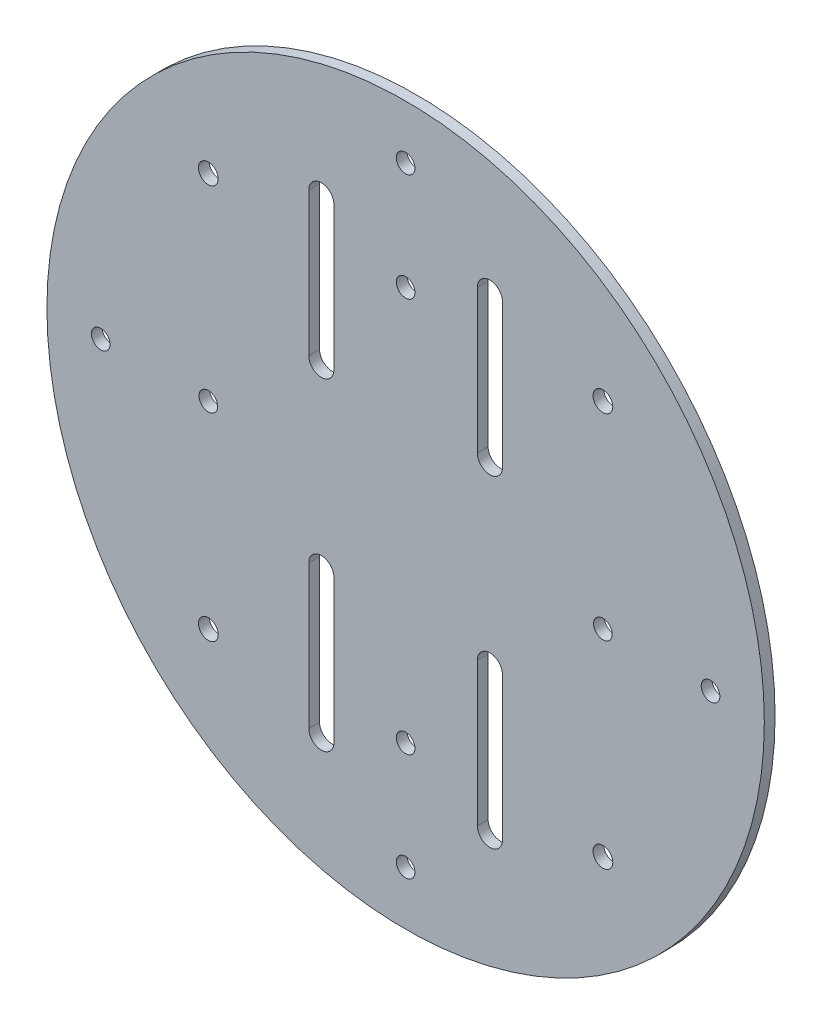
from build123d import *

# Parameters (mm, degrees)
IZIM1_R                              = 100
Y_KSEKLIK_EKSTR_ZYON1_DEPTH          = 30
M5_HELISARMAL_I_IN_Z_VANA_MATKAB_1_D = 5.2
KES_EKSTR_ZYON1_DEPTH                = 145.568322948
M5_BO_LUKLU_DELIK2_D                 = 5.5
IZIM20_R                             = 183.537558205
KES_EKSTR_ZYON2_DEPTH                = 27


with BuildPart() as part:
    # Çizim1 → Yükseklik-Ekstrüzyon1 (new body)
    with BuildSketch(Plane.XY):
        Circle(IZIM1_R)
    extrude(amount=Y_KSEKLIK_EKSTR_ZYON1_DEPTH)

    # M5 Helisarmal için Zıvana matkabı1 (through all)
    with Locations(Plane.XY.offset(30)):
        with Locations((-85, 0), (-55, 0), (0, 55), (0, 85), (55, 0), (85, 0), (0, -55), (0, -85)):
            Hole(M5_HELISARMAL_I_IN_Z_VANA_MATKAB_1_D / 2)

    # Çizim9 → Kes-Ekstrüzyon1 (cut, through all)
    with BuildSketch(Plane.XY.offset(30)):
        with BuildLine():
            Line((27, 65), (27, 25))
            ThreePointArc((27, 25), (23.5, 21.5), (20, 25))
            Line((20, 25), (20, 65))
            ThreePointArc((20, 65), (23.5, 68.5), (27, 65))
        make_face()
        with BuildLine():
            Line((-20, 65), (-20, 25))
            ThreePointArc((-20, 25), (-23.5, 21.5), (-27, 25))
            Line((-27, 25), (-27, 65))
            ThreePointArc((-27, 65), (-23.5, 68.5), (-20, 65))
        make_face()
        with BuildLine():
            Line((-20, -25), (-20, -65))
            ThreePointArc((-20, -65), (-23.5, -68.5), (-27, -65))
            Line((-27, -65), (-27, -25))
            ThreePointArc((-27, -25), (-23.5, -21.5), (-20, -25))
        make_face()
        with BuildLine():
            Line((20, -65), (20, -25))
            ThreePointArc((20, -25), (23.5, -21.5), (27, -25))
            Line((27, -25), (27, -65))
            ThreePointArc((27, -65), (23.5, -68.5), (20, -65))
        make_face()
    extrude(amount=-KES_EKSTR_ZYON1_DEPTH, mode=Mode.SUBTRACT)

    # M5 Boşluklu Delik2 (through all)
    with Locations(Plane.XY.offset(30)):
        with Locations((-55, 55), (55, 55), (55, -55), (-55, -55)):
            Hole(M5_BO_LUKLU_DELIK2_D / 2)

    # Çizim20 → Kes-Ekstrüzyon2 (cut)
    with BuildSketch(Plane.XY.offset(30)):
        with Locations((0, 8.479468632)):
            Circle(IZIM20_R)
    extrude(amount=-KES_EKSTR_ZYON2_DEPTH, mode=Mode.SUBTRACT)


solid = part.part
